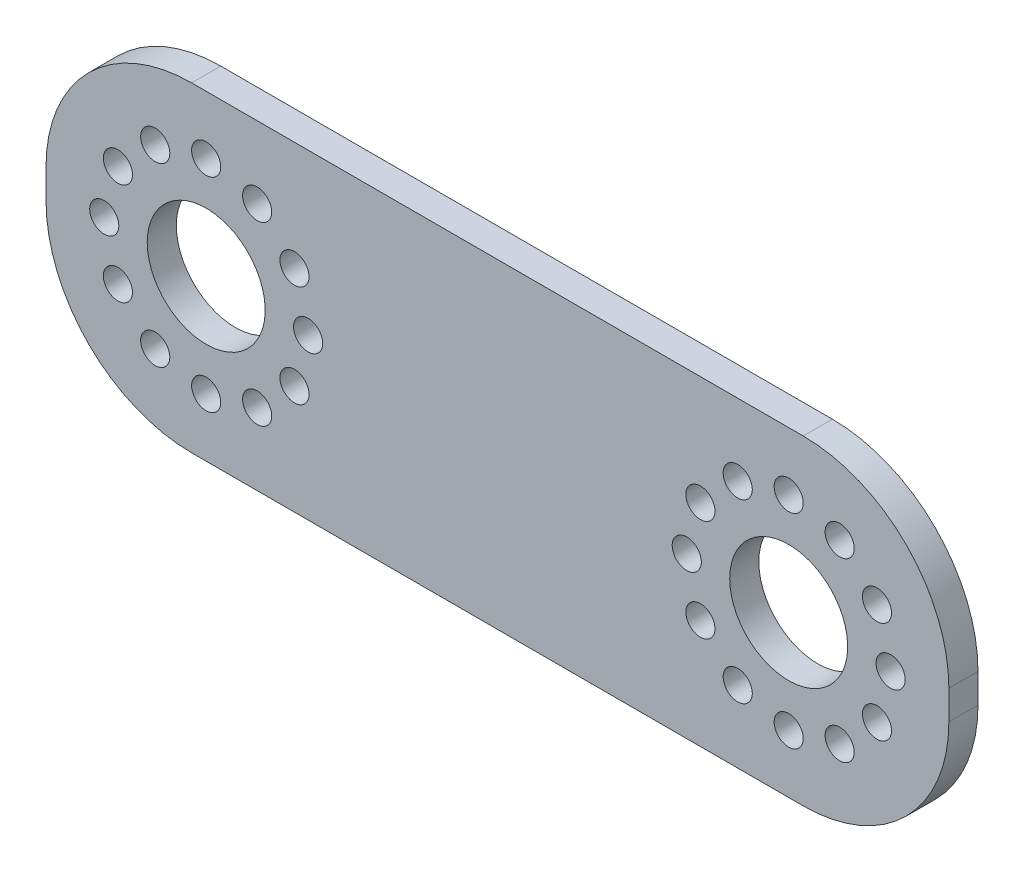
from build123d import *

# Parameters (mm, degrees)
ESQUISSE2_W        = 62
ESQUISSE2_H        = 22
ESQUISSE2_R        = 4.05
ESQUISSE2_R_2      = 1
BOSS_EXTRU_1_DEPTH = 2
CONG_1_R           = 10


with BuildPart() as part:
    # Esquisse2 → Boss.-Extru.1 (new body)
    with BuildSketch(Plane(origin=(0, 0, 0), x_dir=(-1, 0, 0), z_dir=(0, 0, -1))):
        with Locations((-31, 0)):
            Rectangle(ESQUISSE2_W, ESQUISSE2_H)
        with Locations((-11, 0)):
            Circle(ESQUISSE2_R, mode=Mode.SUBTRACT)
        with Locations((-4, 0)):
            Circle(ESQUISSE2_R_2, mode=Mode.SUBTRACT)
        with Locations((-4.937822174, -3.5)):
            Circle(ESQUISSE2_R_2, mode=Mode.SUBTRACT)
        with Locations((-7.5, -6.062177826)):
            Circle(ESQUISSE2_R_2, mode=Mode.SUBTRACT)
        with Locations((-11, -7)):
            Circle(ESQUISSE2_R_2, mode=Mode.SUBTRACT)
        with Locations((-14.5, -6.062177826)):
            Circle(ESQUISSE2_R_2, mode=Mode.SUBTRACT)
        with Locations((-17.062177826, -3.5)):
            Circle(ESQUISSE2_R_2, mode=Mode.SUBTRACT)
        with Locations((-18, 0)):
            Circle(ESQUISSE2_R_2, mode=Mode.SUBTRACT)
        with Locations((-17.062177826, 3.5)):
            Circle(ESQUISSE2_R_2, mode=Mode.SUBTRACT)
        with Locations((-14.5, 6.062177826)):
            Circle(ESQUISSE2_R_2, mode=Mode.SUBTRACT)
        with Locations((-11, 7)):
            Circle(ESQUISSE2_R_2, mode=Mode.SUBTRACT)
        with Locations((-7.5, 6.062177826)):
            Circle(ESQUISSE2_R_2, mode=Mode.SUBTRACT)
        with Locations((-4.937822174, 3.5)):
            Circle(ESQUISSE2_R_2, mode=Mode.SUBTRACT)
        with Locations((-51, 0)):
            Circle(ESQUISSE2_R, mode=Mode.SUBTRACT)
        with Locations((-44, 0)):
            Circle(ESQUISSE2_R_2, mode=Mode.SUBTRACT)
        with Locations((-44.937822174, -3.5)):
            Circle(ESQUISSE2_R_2, mode=Mode.SUBTRACT)
        with Locations((-47.5, -6.062177826)):
            Circle(ESQUISSE2_R_2, mode=Mode.SUBTRACT)
        with Locations((-51, -7)):
            Circle(ESQUISSE2_R_2, mode=Mode.SUBTRACT)
        with Locations((-54.5, -6.062177826)):
            Circle(ESQUISSE2_R_2, mode=Mode.SUBTRACT)
        with Locations((-57.062177826, -3.5)):
            Circle(ESQUISSE2_R_2, mode=Mode.SUBTRACT)
        with Locations((-58, 0)):
            Circle(ESQUISSE2_R_2, mode=Mode.SUBTRACT)
        with Locations((-57.062177826, 3.5)):
            Circle(ESQUISSE2_R_2, mode=Mode.SUBTRACT)
        with Locations((-54.5, 6.062177826)):
            Circle(ESQUISSE2_R_2, mode=Mode.SUBTRACT)
        with Locations((-51, 7)):
            Circle(ESQUISSE2_R_2, mode=Mode.SUBTRACT)
        with Locations((-47.5, 6.062177826)):
            Circle(ESQUISSE2_R_2, mode=Mode.SUBTRACT)
        with Locations((-44.937822174, 3.5)):
            Circle(ESQUISSE2_R_2, mode=Mode.SUBTRACT)
    extrude(amount=-BOSS_EXTRU_1_DEPTH)

    # Congé1
    cong_1_edges = [part.edges().sort_by_distance(p)[0] for p in [
        (62, 11, 1),
        (0, 11, 1),
        (0, -11, 1),
        (62, -11, 1),
    ]]
    fillet(cong_1_edges, radius=CONG_1_R)


solid = part.part
